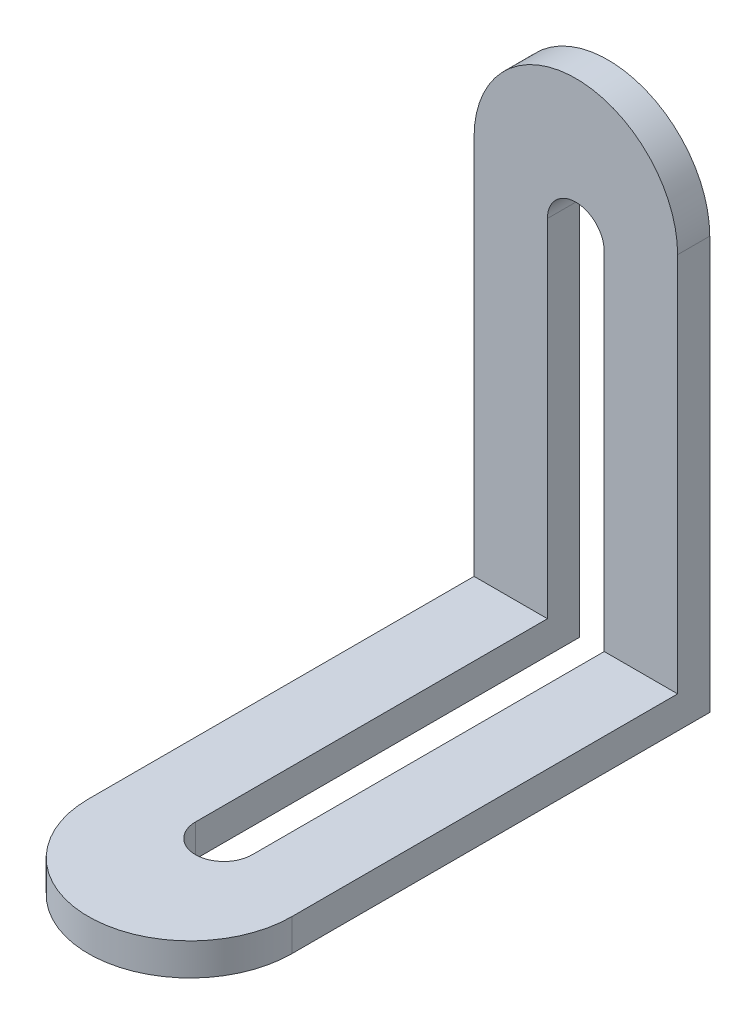
from build123d import *

# Parameters (mm, degrees)
EXTRUDE_1_DEPTH = 3
EXTRUDE_2_DEPTH = 3


with BuildPart() as part:
    # 草图1 → 凸台-拉伸1 (new body)
    with BuildSketch(Plane.XY):
        with BuildLine():
            ThreePointArc((-17.306693672, 14.907284768), (-26.806693672, 24.407284768), (-36.306693672, 14.907284768))
            ThreePointArc((-36.306693672, 14.907284768), (-34.403568029, 9.203119623), (-29.456693672, 5.784374048))
            Line((-29.456693672, 5.784374048), (-29.456693672, 11.757284768))
            ThreePointArc((-29.456693672, 11.757284768), (-26.806693672, 14.407284768), (-24.156693672, 11.757284768))
            Line((-24.156693672, 11.757284768), (-24.156693672, 5.784374048))
            ThreePointArc((-24.156693672, 5.784374048), (-19.209819315, 9.203119623), (-17.306693672, 14.907284768))
        make_face()
        with BuildLine():
            ThreePointArc((-29.456693672, 5.784374048), (-34.403568029, 9.203119623), (-36.306693672, 14.907284768))
            Line((-36.306693672, 14.907284768), (-36.306693672, -23.592715232))
            Line((-36.306693672, -23.592715232), (-29.456693672, -23.592715232))
            Line((-29.456693672, -23.592715232), (-29.456693672, 5.784374048))
        make_face()
        with BuildLine():
            Line((-17.306693672, -23.592715232), (-17.306693672, 14.907284768))
            ThreePointArc((-17.306693672, 14.907284768), (-19.209819315, 9.203119623), (-24.156693672, 5.784374048))
            Line((-24.156693672, 5.784374048), (-24.156693672, -23.592715232))
            Line((-24.156693672, -23.592715232), (-17.306693672, -23.592715232))
        make_face()
    extrude(amount=-EXTRUDE_1_DEPTH)

    # 草图2 → 凸台-拉伸2 (add)
    with BuildSketch(Plane.XZ.offset(23.592715232)):
        with BuildLine():
            ThreePointArc((-34.81143952, 41.116057458), (-35.925221118, 38.665043569), (-36.306693672, 36))
            ThreePointArc((-36.306693672, 36), (-34.403568029, 30.295834855), (-29.456693672, 26.87708928))
            Line((-29.456693672, 26.87708928), (-29.456693672, 32.85))
            ThreePointArc((-29.456693672, 32.85), (-26.806693672, 35.5), (-24.156693672, 32.85))
            Line((-24.156693672, 32.85), (-24.156693672, 26.87708928))
            ThreePointArc((-24.156693672, 26.87708928), (-19.209819315, 30.295834855), (-17.306693672, 36))
            ThreePointArc((-17.306693672, 36), (-17.688166227, 38.665043569), (-18.801947824, 41.116057458))
            Line((-18.801947824, 41.116057458), (-34.81143952, 41.116057458))
        make_face()
        with BuildLine():
            ThreePointArc((-18.801947824, 41.116057458), (-26.806693672, 45.5), (-34.81143952, 41.116057458))
            Line((-34.81143952, 41.116057458), (-18.801947824, 41.116057458))
        make_face()
        with BuildLine():
            Line((-36.306693672, 36), (-36.306693672, 0))
            Line((-36.306693672, 0), (-29.456693672, 0))
            Line((-29.456693672, 0), (-29.456693672, 26.87708928))
            ThreePointArc((-29.456693672, 26.87708928), (-34.403568029, 30.295834855), (-36.306693672, 36))
        make_face()
        with BuildLine():
            Line((-24.156693672, 26.87708928), (-24.156693672, -3))
            Line((-24.156693672, -3), (-17.306693672, -3))
            Line((-17.306693672, -3), (-17.306693672, 36))
            ThreePointArc((-17.306693672, 36), (-19.209819315, 30.295834855), (-24.156693672, 26.87708928))
        make_face()
    extrude(amount=-EXTRUDE_2_DEPTH)


solid = part.part
